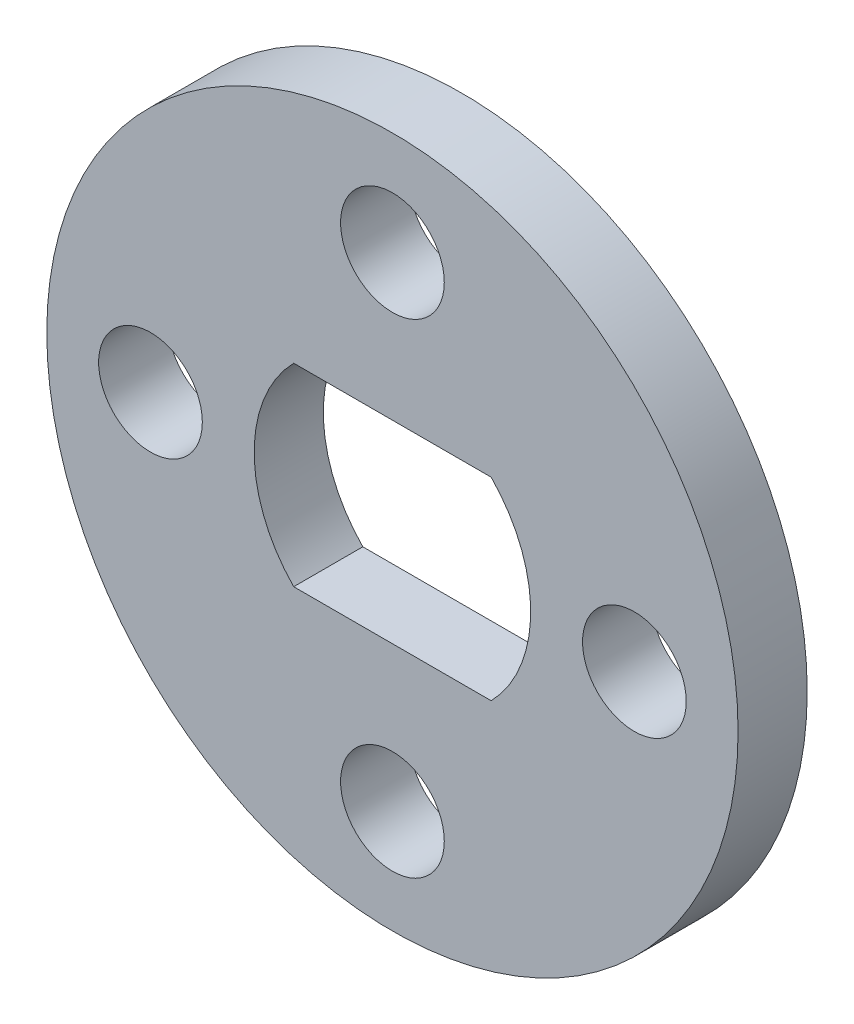
from build123d import *

# Parameters (mm, degrees)
SKETCH_1_R          = 10
SKETCH_1_R_2        = 1.5
EXTRUDE_1_DEPTH     = 2
CUT_EXTRUDE_1_DEPTH = 15.282856857


with BuildPart() as part:
    # 草图1 → 凸台-拉伸1 (new body)
    with BuildSketch(Plane.XY):
        Circle(SKETCH_1_R)
        with Locations((0, 7)):
            Circle(SKETCH_1_R_2, mode=Mode.SUBTRACT)
        with Locations((7, 0)):
            Circle(SKETCH_1_R_2, mode=Mode.SUBTRACT)
        with Locations((-7, 0)):
            Circle(SKETCH_1_R_2, mode=Mode.SUBTRACT)
        with Locations((0, -7)):
            Circle(SKETCH_1_R_2, mode=Mode.SUBTRACT)
    extrude(amount=EXTRUDE_1_DEPTH)

    # 草图2 → 切除-拉伸1 (cut, through all)
    with BuildSketch(Plane(origin=(0, 0, 0), x_dir=(-1, 0, 0), z_dir=(0, 0, -1))):
        with BuildLine():
            Line((-2.856571371, 2.8), (2.856571371, 2.8))
            ThreePointArc((2.856571371, 2.8), (4, 0), (2.856571371, -2.8))
            Line((2.856571371, -2.8), (-2.856571371, -2.8))
            ThreePointArc((-2.856571371, -2.8), (-4, 0), (-2.856571371, 2.8))
        make_face()
    extrude(amount=-CUT_EXTRUDE_1_DEPTH, mode=Mode.SUBTRACT)


solid = part.part
